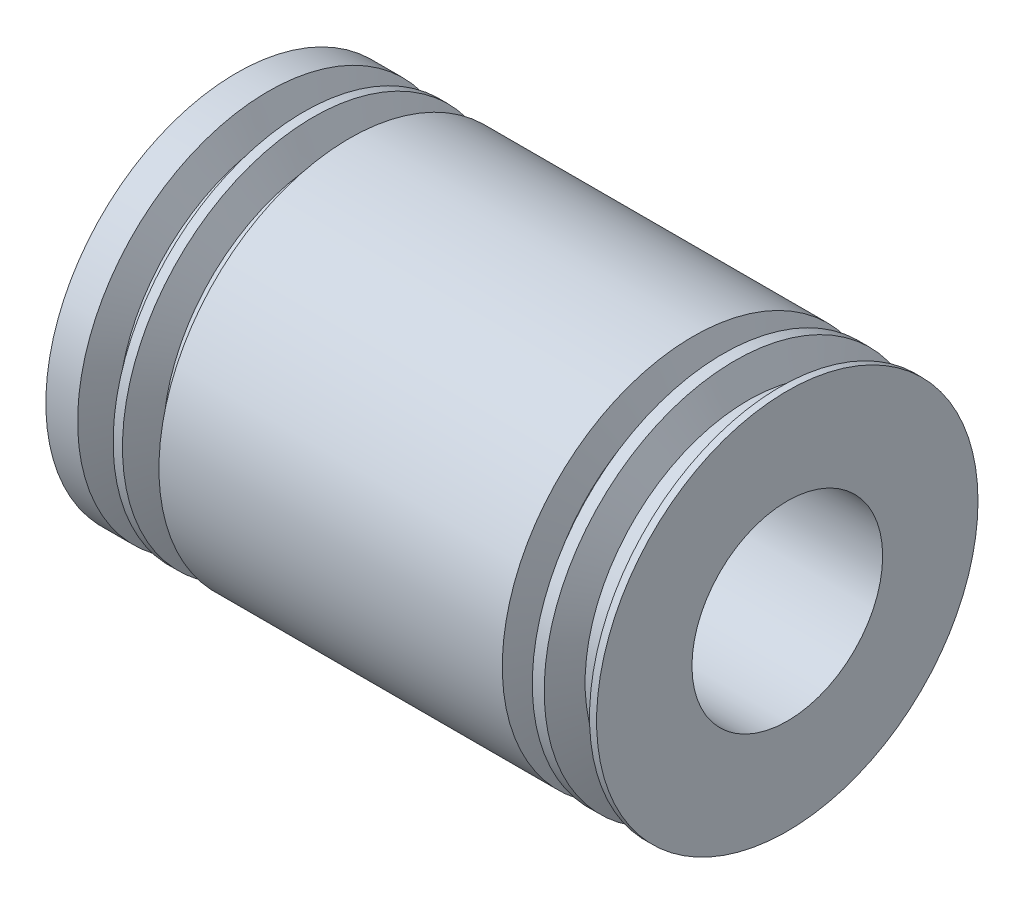
from build123d import *


with BuildPart() as part:
    # Szkic1 → Obrót1 (revolve)
    with BuildSketch(Plane.XY, mode=Mode.PRIVATE) as obr_t1_sk:
        Polygon((-2.324733291, 2.132645156), (-2.639292136, 3), (-13.441762305, 3), (-13.907929964, 2.132645156), (-14.17640763, 2.132645156), (-14.589993676, 3), (-14.883717364, 3), (-15.363713775, 2.132645156), (-15.586413954, 2.132645156), (-16, 3), (-17, 3), (-17, 0), (0, 0), (0.327556569, 0), (0.327556569, 3), (0.104856391, 3), (-0.375140021, 2.132645156), (-0.901728995, 2.132645156), (-1.321140788, 3), (-1.695615602, 3), (-2.008291441, 2.132645156), align=None)
    revolve(obr_t1_sk.sketch.rotate(Axis((0.327556569, -3, 0), (-1, 0, 0)), 90), axis=Axis((0.327556569, -3, 0), (-1, 0, 0)))


solid = part.part
